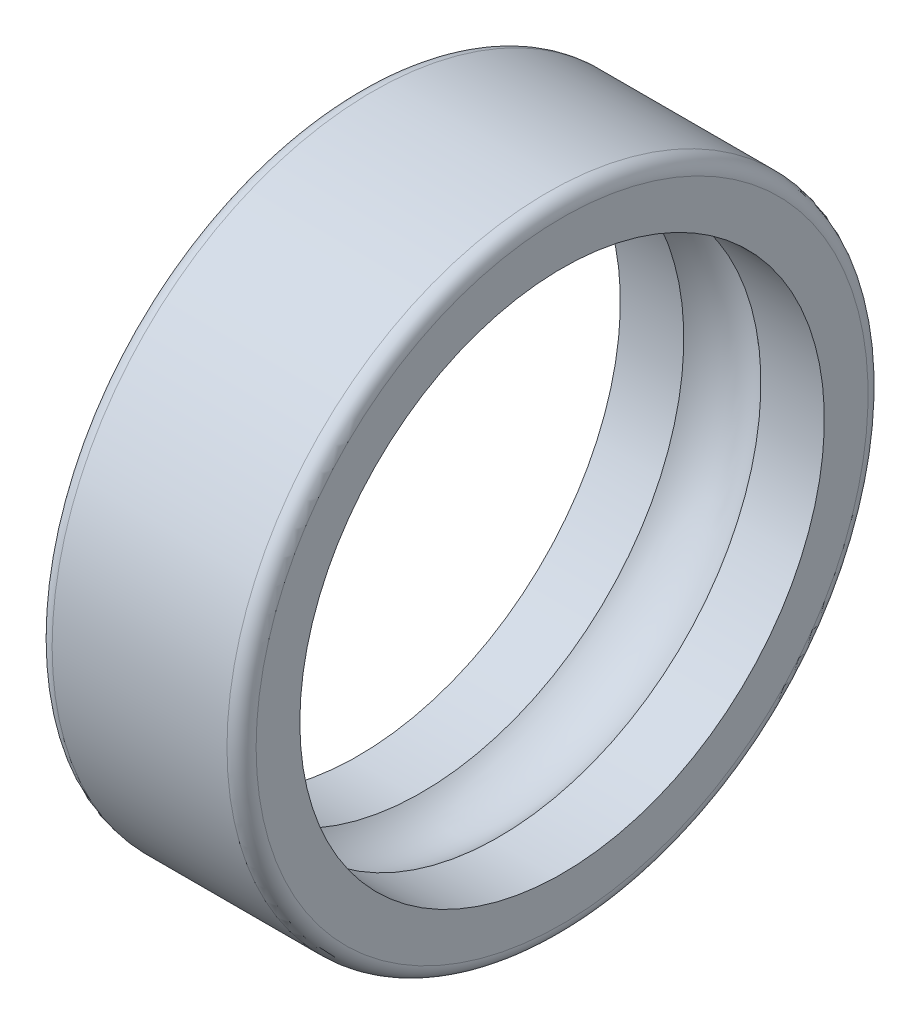
from build123d import *


with BuildPart() as part:
    # Esquisse1 → Base-Révolution (revolve)
    with BuildSketch(Plane.XY, mode=Mode.PRIVATE) as base_r_volution_sk:
        with BuildLine():
            Line((-3, 11), (3, 11))
            ThreePointArc((3, 11), (3.353553391, 10.853553391), (3.5, 10.5))
            Line((3.5, 10.5), (3.5, 9))
            Line((3.5, 9), (1.322875656, 9))
            ThreePointArc((1.322875656, 9), (0, 9.5), (-1.322875656, 9))
            Line((-1.322875656, 9), (-3.5, 9))
            Line((-3.5, 9), (-3.5, 10.5))
            ThreePointArc((-3.5, 10.5), (-3.353553391, 10.853553391), (-3, 11))
        make_face()
    revolve(base_r_volution_sk.sketch.rotate(Axis((0, 0, 0), (1, 0, 0)), 90), axis=Axis((0, 0, 0), (1, 0, 0)))


solid = part.part
